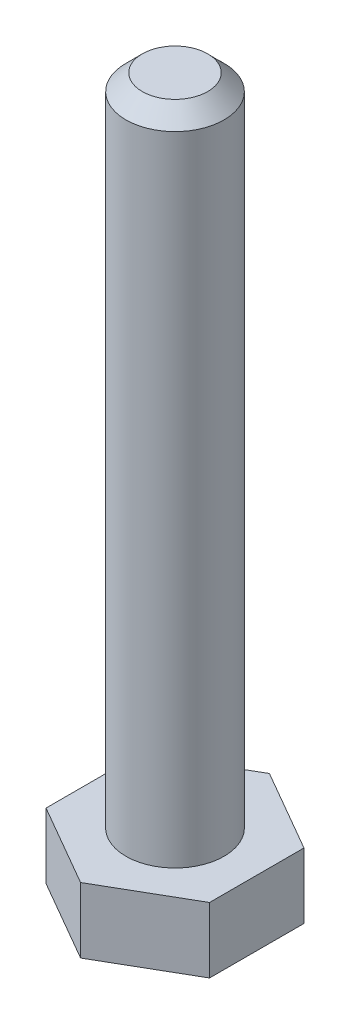
from build123d import *

# Parameters (mm, degrees)
BOSS_EXTRUDE1_DEPTH = 4
SKETCH2_R           = 3
BOSS_EXTRUDE2_DEPTH = 40
CHAMFER1_SIZE       = 1


with BuildPart() as part:
    # Sketch1 → Boss-Extrude1 (new body)
    with BuildSketch(Plane(origin=(0, 0, 0), x_dir=(1, 0, 0), z_dir=(0, 1, 0))):
        Polygon((0, 5.773502692), (-5, 2.886751346), (-5, -2.886751346), (0, -5.773502692), (5, -2.886751346), (5, 2.886751346), align=None)
    extrude(amount=BOSS_EXTRUDE1_DEPTH)

    # Sketch2 → Boss-Extrude2 (add)
    with BuildSketch(Plane(origin=(0, 4, 0), x_dir=(1, 0, 0), z_dir=(0, 1, 0))):
        with Locations(Location((0, 0, 0), (0, 0, 270))):
            Circle(SKETCH2_R)
    extrude(amount=BOSS_EXTRUDE2_DEPTH)

    # Chamfer1
    chamfer1_edges = [part.edges().sort_by_distance(p)[0] for p in [
        (0, 44, -3),
    ]]
    chamfer(chamfer1_edges, length=CHAMFER1_SIZE)


solid = part.part
